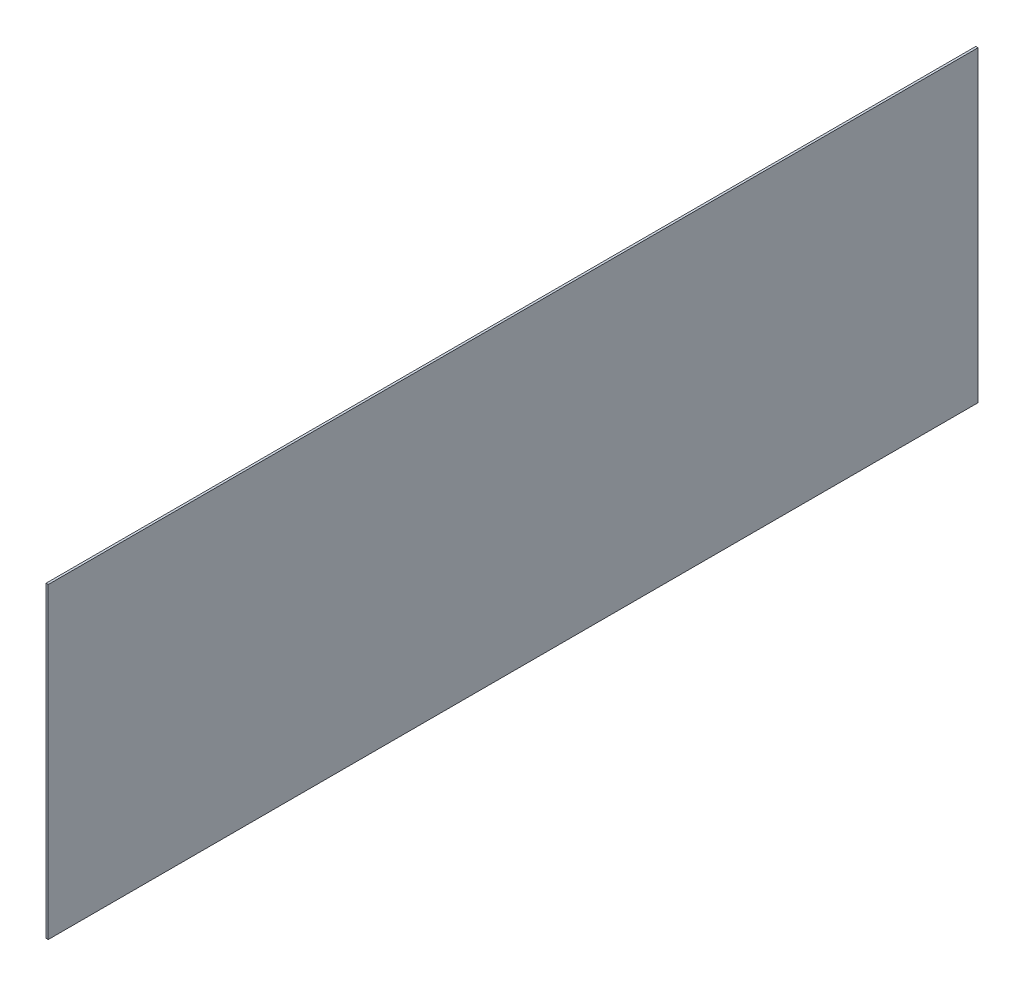
from build123d import *

# Parameters (mm, degrees)
SKETCH1_W           = 414.644000022
SKETCH1_H           = 137.123665554
BOSS_EXTRUDE1_DEPTH = 1


with BuildPart() as part:
    # Sketch1 → Boss-Extrude1 (new body)
    with BuildSketch(Plane(origin=(0, 0, 0), x_dir=(0, 0, -1), z_dir=(1, 0, 0))):
        with Locations((207.322000011, 68.561832777)):
            Rectangle(SKETCH1_W, SKETCH1_H)
    extrude(amount=BOSS_EXTRUDE1_DEPTH)


solid = part.part
